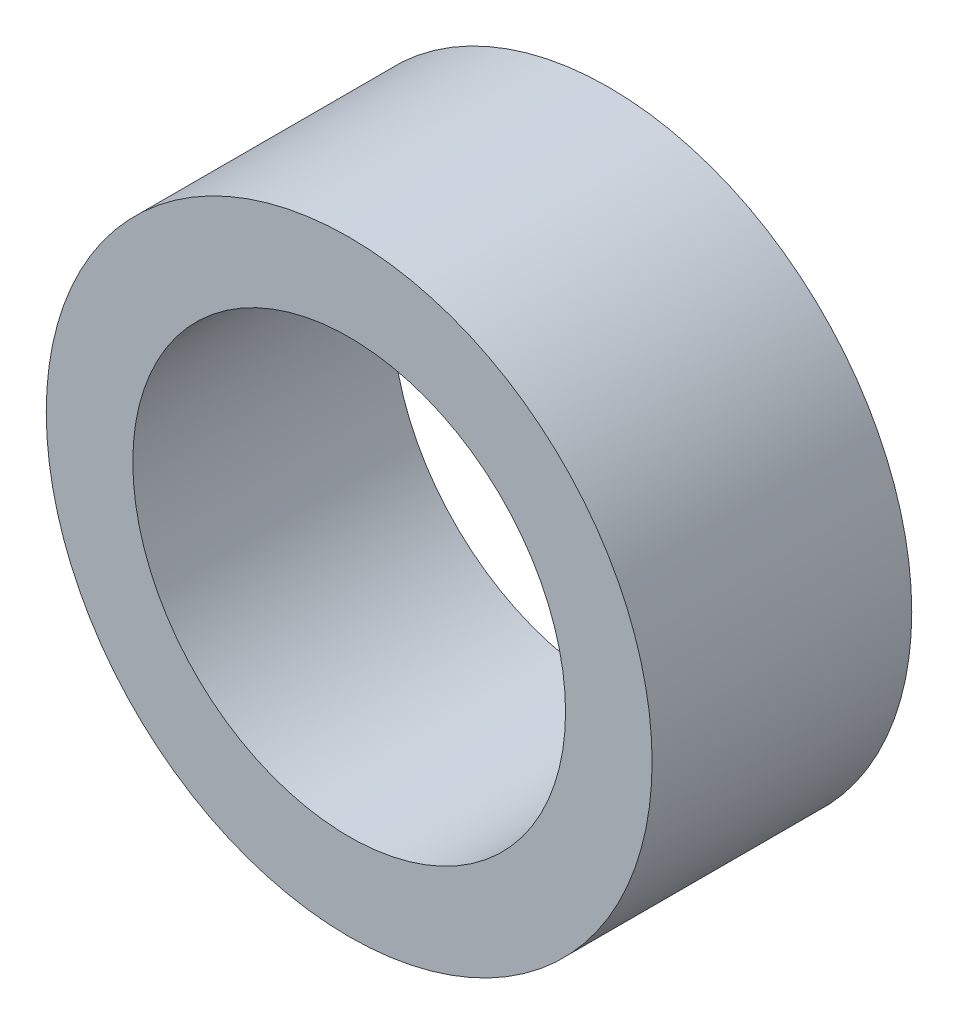
from build123d import *

# Parameters (mm, degrees)
SKETCH1_R           = 3.5
SKETCH1_R_2         = 2.5
BOSS_EXTRUDE1_DEPTH = 3


with BuildPart() as part:
    # Sketch1 → Boss-Extrude1 (new body)
    with BuildSketch(Plane.XY):
        Circle(SKETCH1_R)
        Circle(SKETCH1_R_2, mode=Mode.SUBTRACT)
    extrude(amount=BOSS_EXTRUDE1_DEPTH)


solid = part.part
